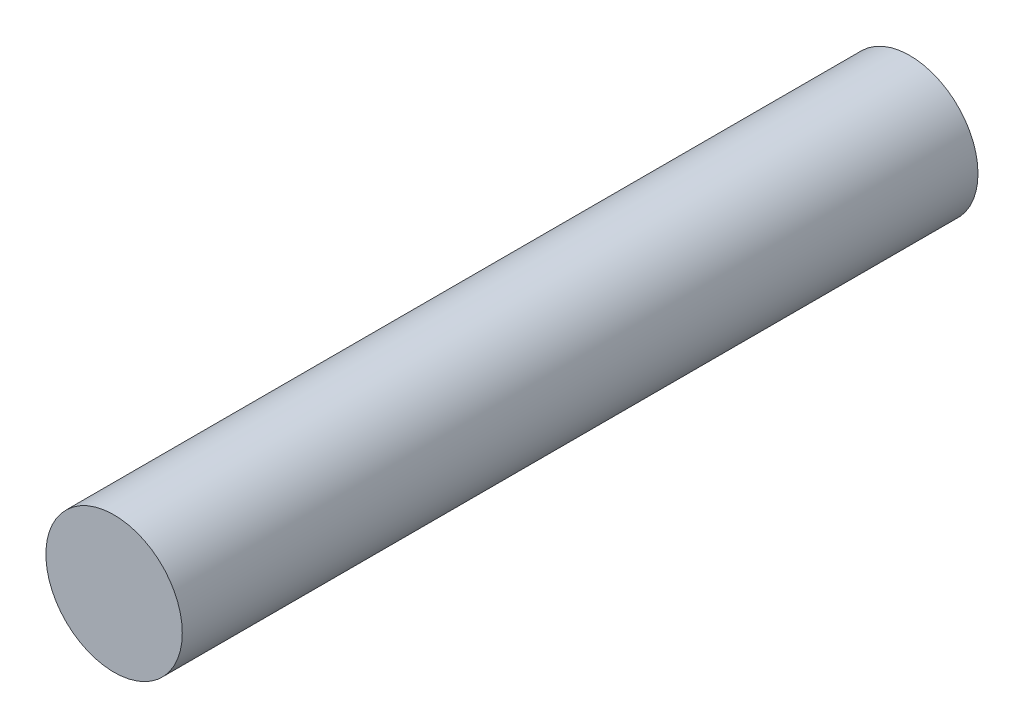
from build123d import *

# Parameters (mm, degrees)
SKETCH1_R           = 30
BOSS_EXTRUDE1_DEPTH = 350


with BuildPart() as part:
    # Sketch1 → Boss-Extrude1 (new body)
    with BuildSketch(Plane.XY):
        Circle(SKETCH1_R)
    extrude(amount=BOSS_EXTRUDE1_DEPTH)


solid = part.part
